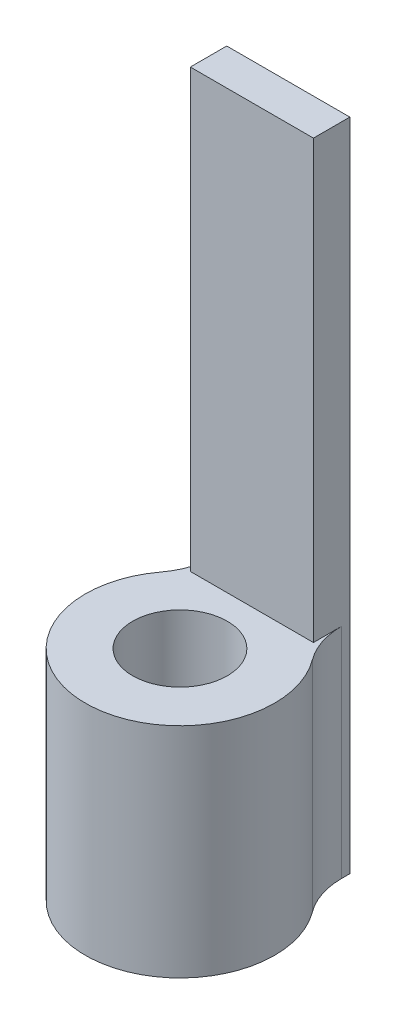
from build123d import *

# Parameters (mm, degrees)
SKETCH_1_R      = 1.3
EXTRUDE_1_DEPTH = 6
SKETCH_2_W      = 3.381536624
SKETCH_2_H      = 1
EXTRUDE_2_DEPTH = 18
FILLET_1_R      = 2


with BuildPart() as part:
    # Эскиз1 → Бобышка-Вытянуть1 (new body)
    with BuildSketch(Plane(origin=(0, 0, 0), x_dir=(1, 0, 0), z_dir=(0, 1, 0))):
        with BuildLine():
            Line((-1.690768312, 1.975171515), (1.690768312, 1.975171515))
            ThreePointArc((1.690768312, 1.975171515), (0, -2.6), (-1.690768312, 1.975171515))
        make_face()
        with Locations(Location((0, 0, 0), (0, 0, 270))):
            Circle(SKETCH_1_R, mode=Mode.SUBTRACT)
    extrude(amount=EXTRUDE_1_DEPTH)

    # Эскиз2 → Бобышка-Вытянуть2 (add)
    with BuildSketch(Plane.XZ):
        with Locations((0, -2.475171515)):
            Rectangle(SKETCH_2_W, SKETCH_2_H)
    extrude(amount=-EXTRUDE_2_DEPTH)

    # Скругление1
    fillet_1_edges = [part.edges().sort_by_distance(p)[0] for p in [
        (-1.690768312, 3, -1.975171515),
        (1.690768312, 3, -1.975171515),
    ]]
    fillet(fillet_1_edges, radius=FILLET_1_R)


solid = part.part
